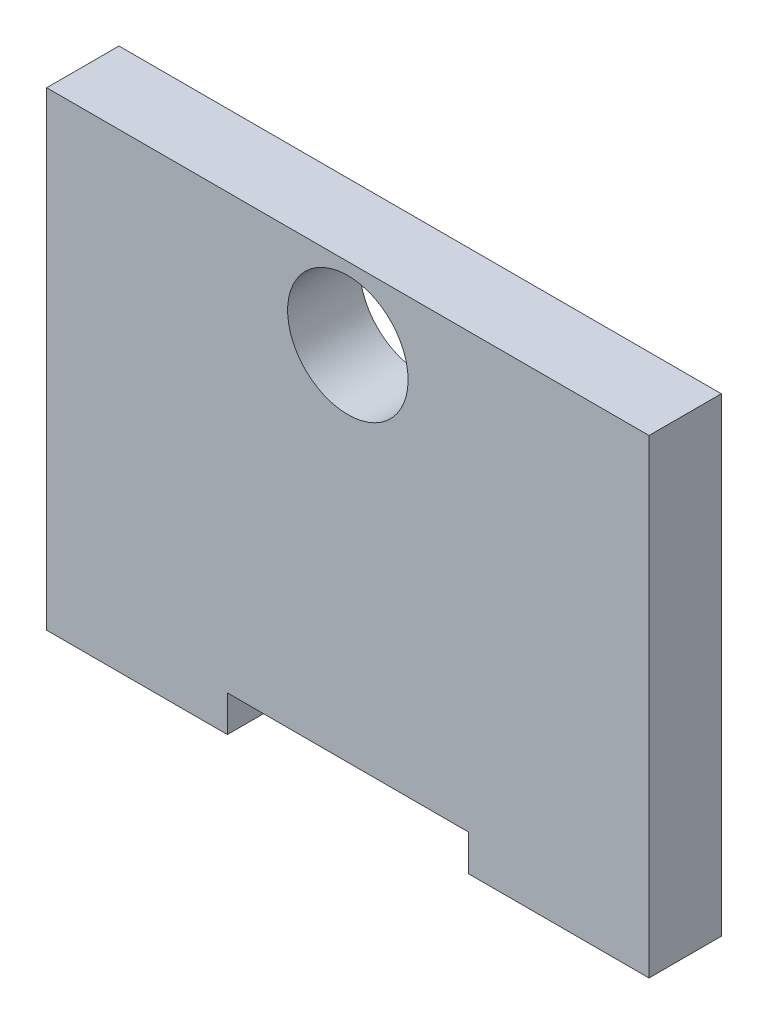
from build123d import *

# Parameters (mm, degrees)
ESQUISSE1_R        = 5
BOSS_EXTRU_1_DEPTH = 6


with BuildPart() as part:
    # Esquisse1 → Boss.-Extru.1 (new body)
    with BuildSketch(Plane.XY):
        Polygon((15, 0), (35, 0), (35, -3), (50, -3), (50, 0), (50, 36), (0, 36), (0, 0), (0, -3), (15, -3), align=None)
        with Locations((25, 30)):
            Circle(ESQUISSE1_R, mode=Mode.SUBTRACT)
    extrude(amount=BOSS_EXTRU_1_DEPTH)


solid = part.part
